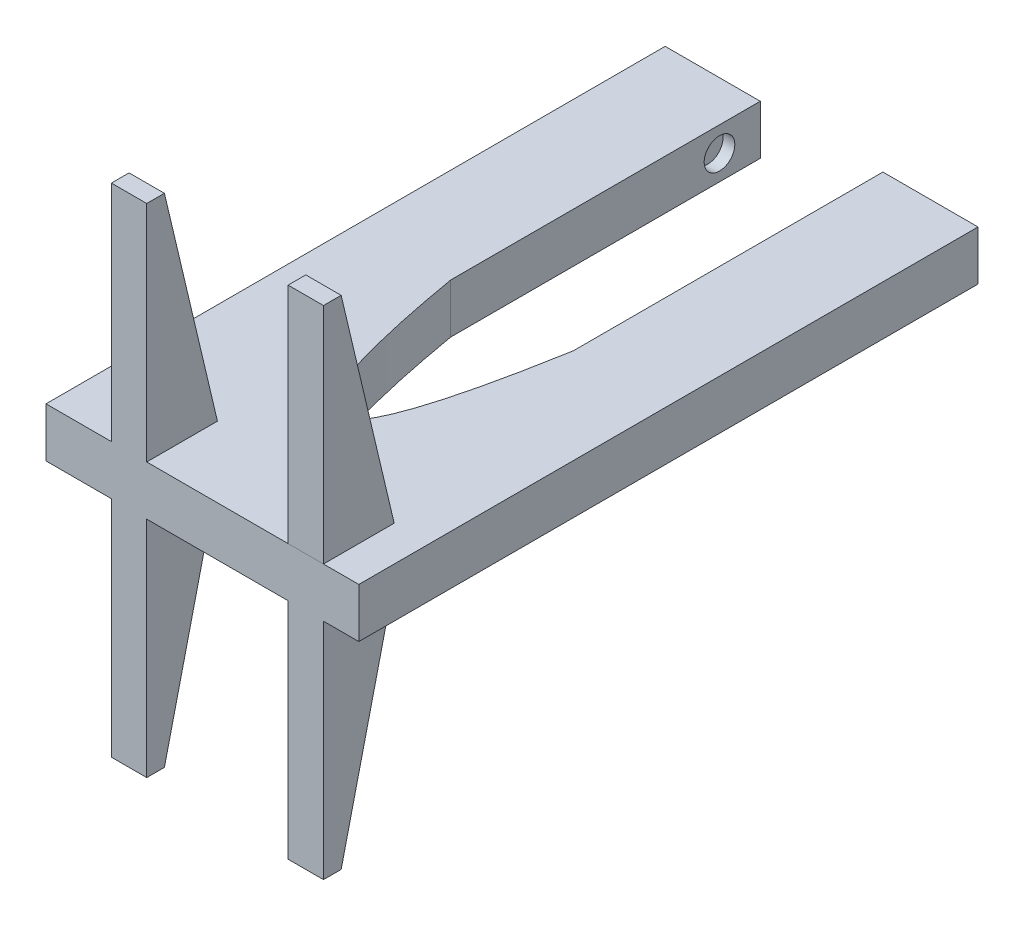
from build123d import *

# Parameters (mm, degrees)
BOSS_EXTRUDE1_DEPTH = 420
BOSS_EXTRUDE2_DEPTH = 300
BOSS_EXTRUDE3_DEPTH = 300
CUT_EXTRUDE2_START  = -706
SKETCH4_R           = 130
CUT_EXTRUDE2_DEPTH  = 1242


with BuildPart() as part:
    # Sketch1 → Boss-Extrude1 (new body)
    with BuildSketch(Plane(origin=(0, 0, 0), x_dir=(1, 0, 0), z_dir=(0, 1, 0))):
        with BuildLine():
            Line((300, 0), (300, -5255))
            Line((300, -5255), (-2355, -5255))
            Line((-2355, -5255), (-2355, -4455))
            Line((-2355, -4455), (-2355, 0))
            Line((-2355, 0), (-1548, 0))
            Line((-1548, 0), (-1548, -2627.5))
            add(Edge.make_bspline(
                [(-1548, -2627.5), (-1027.5, -5612.886868633), (-507, -2627.5)],
                knots=[0, 0, 0, 1, 1, 1], degree=2))
            Line((-507, -2627.5), (-507, 0))
            Line((-507, 0), (300, 0))
        make_face()
    extrude(amount=BOSS_EXTRUDE1_DEPTH)

    # Sketch2 → Boss-Extrude2 (add)
    with BuildSketch(Plane(origin=(-1800, 0, 0), x_dir=(0, 0, -1), z_dir=(1, 0, 0))):
        Polygon((-5255, 420), (-5255, 2320), (-5105, 2320), (-4655, 420), align=None)
    boss_extrude2 = extrude(amount=BOSS_EXTRUDE2_DEPTH)


with BuildPart() as body_2:
    # Sketch3 → Boss-Extrude3 (new body)
    with BuildSketch(Plane(origin=(0, 0, 0), x_dir=(0, 0, -1), z_dir=(1, 0, 0))):
        Polygon((-5255, 420), (-5255, 2320), (-5105, 2320), (-4655, 420), align=None)
    boss_extrude3 = extrude(amount=-BOSS_EXTRUDE3_DEPTH)


with BuildPart() as part_1:
    add(part.part)

    # Mirror13: Boss-Extrude3 across plane
    add(boss_extrude3.mirror(Plane.ZX.offset(210)))

    # Mirror14: Boss-Extrude2 across plane
    add(boss_extrude2.mirror(Plane.ZX.offset(210)))

    # Sketch4 → Cut-Extrude2 (cut)
    with BuildSketch(Plane(origin=(300, 0, 0), x_dir=(0, 0, -1), z_dir=(1, 0, 0)).offset(CUT_EXTRUDE2_START)):
        with Locations((-346.012024202, 210)):
            Circle(SKETCH4_R)
    extrude(amount=-CUT_EXTRUDE2_DEPTH, mode=Mode.SUBTRACT)


solid = Compound([body_2.part, part_1.part])
